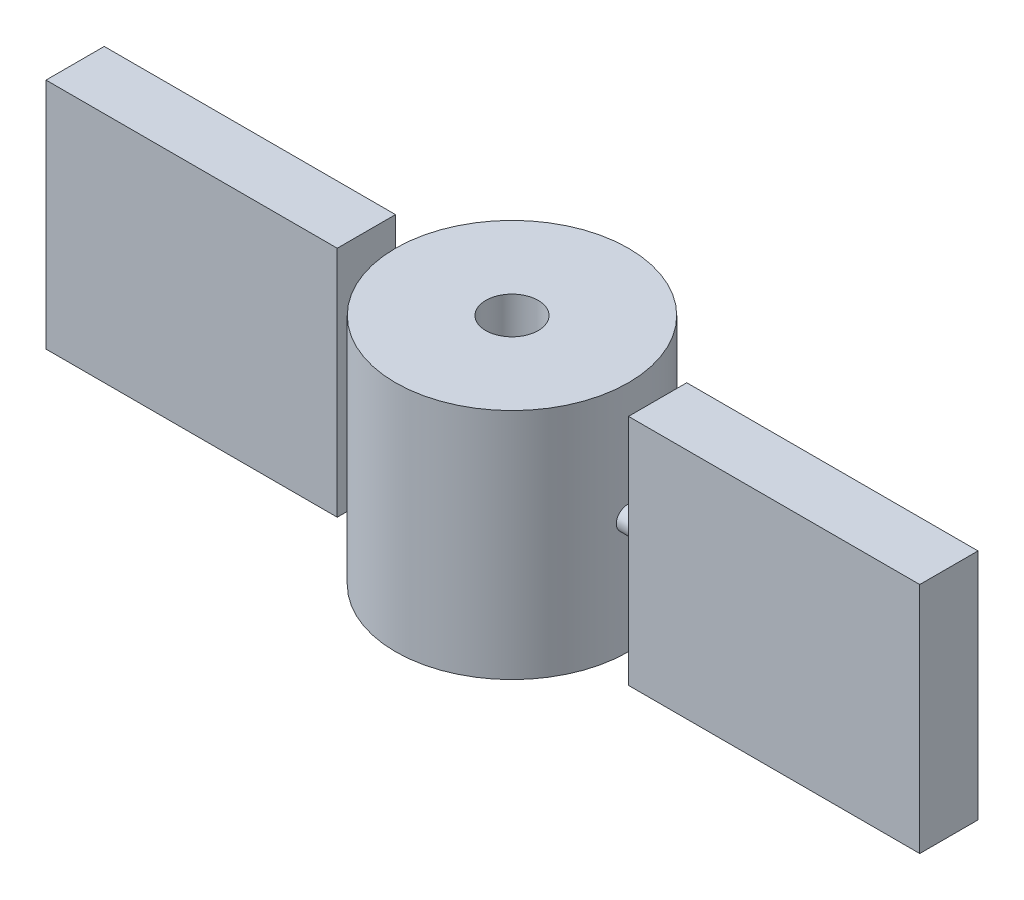
from build123d import *

# Parameters (mm, degrees)
SKETCH1_R             = 20
BOSS_EXTRUDE1_DEPTH   = 40
BOSS_EXTRUDE2_DEPTH   = 5
BOSS_EXTRUDE2_2_DEPTH = 5
SKETCH7_R             = 2
BOSS_EXTRUDE3_DEPTH   = 50
SKETCH9_R             = 4.5
CUT_EXTRUDE1_DEPTH    = 30
SKETCH9_3_R           = 2.15
CUT_EXTRUDE2_DEPTH    = 88.321246052


with BuildPart() as part:
    # Sketch1 → Boss-Extrude1 (new body)
    with BuildSketch(Plane(origin=(0, 0, 0), x_dir=(1, 0, 0), z_dir=(0, 1, 0))):
        Circle(SKETCH1_R)
    extrude(amount=BOSS_EXTRUDE1_DEPTH)



with BuildPart() as body_2:
    # Sketch2 → Boss-Extrude2 (new, symmetric)
    with BuildSketch(Plane.XY):
        Polygon((-25, 0), (-25, 20), (-25, 40), (-75, 40), (-75, 0), align=None)
    extrude(amount=BOSS_EXTRUDE2_DEPTH, both=True)


with BuildPart() as body_3:
    # Sketch2 → Boss-Extrude2 2 (new, symmetric)
    with BuildSketch(Plane.XY):
        Polygon((25, 40), (25, 20), (25, 0), (75, 0), (75, 40), align=None)
    extrude(amount=BOSS_EXTRUDE2_2_DEPTH, both=True)


with BuildPart() as part_1:
    add(part.part)

    add(body_2.part)  # Boss-Extrude3 merges body 2

    add(body_3.part)  # Boss-Extrude3 merges body 3
    # Sketch7 → Boss-Extrude3 (add, symmetric)
    with BuildSketch(Plane(origin=(0, 0, 0), x_dir=(0, 0, -1), z_dir=(1, 0, 0))):
        with Locations((0, 20)):
            Circle(SKETCH7_R)
    extrude(amount=BOSS_EXTRUDE3_DEPTH, both=True)

    # Sketch9 → Cut-Extrude1 (cut)
    with BuildSketch(Plane(origin=(0, 40, 0), x_dir=(1, 0, 0), z_dir=(0, 1, 0))):
        Circle(SKETCH9_R)
    extrude(amount=-CUT_EXTRUDE1_DEPTH, mode=Mode.SUBTRACT)

    # Sketch9<3> → Cut-Extrude2 (cut, through all)
    with BuildSketch(Plane(origin=(0, 40, 0), x_dir=(1, 0, 0), z_dir=(0, 1, 0))):
        Circle(SKETCH9_3_R)
    extrude(amount=-CUT_EXTRUDE2_DEPTH, mode=Mode.SUBTRACT)


solid = part_1.part
